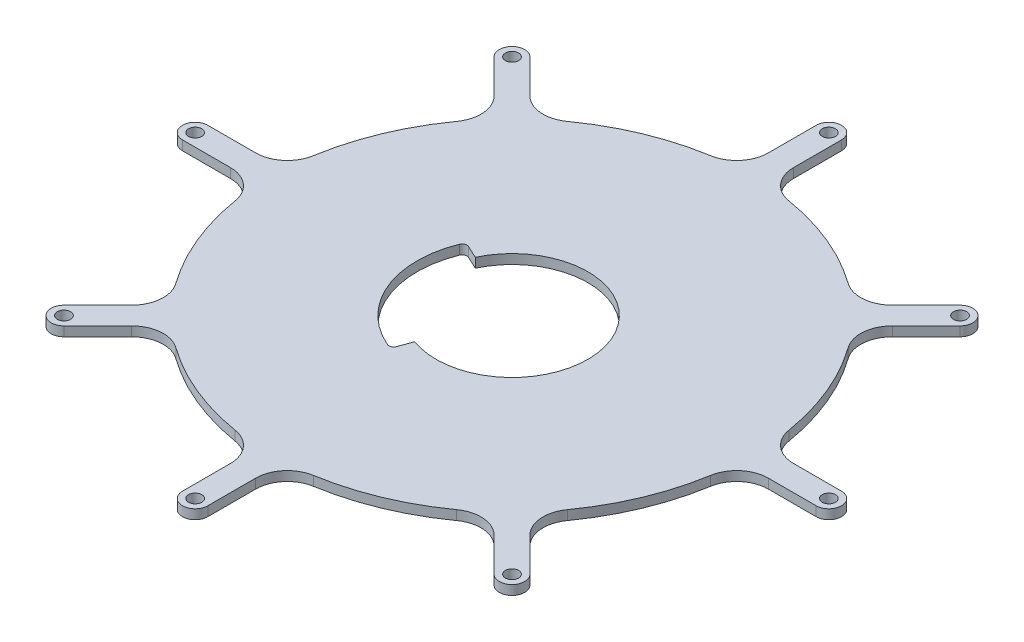
from build123d import *

# Parameters (mm, degrees)
BOSS_EXTRUDE1_DEPTH = 3
SKETCH3_R           = 2.1
CUT_EXTRUDE1_DEPTH  = 5
FILLET1_R           = 10
SKETCH4_R           = 24
CUT_EXTRUDE2_DEPTH  = 10


with BuildPart() as part:
    # Sketch1 → Boss-Extrude1 (new body)
    with BuildSketch(Plane(origin=(0, 0, 0), x_dir=(1, 0, 0), z_dir=(0, 1, 0))):
        with BuildLine():
            ThreePointArc((36.740234303, -4), (32.740234303, 0), (36.740234303, 4))
            Line((36.740234303, 4), (76.064899264, 4))
            ThreePointArc((76.064899264, 4), (70.371903991, 29.148997043), (56.614433204, 50.957578955))
            Line((56.614433204, 50.957578955), (28.807695942, 23.150841693))
            ThreePointArc((28.807695942, 23.150841693), (23.150841693, 23.150841693), (23.150841693, 28.807695942))
            Line((23.150841693, 28.807695942), (50.957578955, 56.614433204))
            ThreePointArc((50.957578955, 56.614433204), (29.148997043, 70.371903991), (4, 76.064899264))
            Line((4, 76.064899264), (4, 36.740234303))
            ThreePointArc((4, 36.740234303), (0, 32.740234303), (-4, 36.740234303))
            Line((-4, 36.740234303), (-4, 76.064899264))
            ThreePointArc((-4, 76.064899264), (-29.148997043, 70.371903991), (-50.957578955, 56.614433204))
            Line((-50.957578955, 56.614433204), (-23.150841693, 28.807695942))
            ThreePointArc((-23.150841693, 28.807695942), (-23.150841693, 23.150841693), (-28.807695942, 23.150841693))
            Line((-28.807695942, 23.150841693), (-56.614433204, 50.957578955))
            ThreePointArc((-56.614433204, 50.957578955), (-70.371903991, 29.148997043), (-76.064899264, 4))
            Line((-76.064899264, 4), (-36.740234303, 4))
            ThreePointArc((-36.740234303, 4), (-32.740234303, 0), (-36.740234303, -4))
            Line((-36.740234303, -4), (-76.064899264, -4))
            ThreePointArc((-76.064899264, -4), (-70.371903991, -29.148997043), (-56.614433204, -50.957578955))
            Line((-56.614433204, -50.957578955), (-28.807695942, -23.150841693))
            ThreePointArc((-28.807695942, -23.150841693), (-23.150841693, -23.150841693), (-23.150841693, -28.807695942))
            Line((-23.150841693, -28.807695942), (-50.957578955, -56.614433204))
            ThreePointArc((-50.957578955, -56.614433204), (-29.148997043, -70.371903991), (-4, -76.064899264))
            Line((-4, -76.064899264), (-4, -36.740234303))
            ThreePointArc((-4, -36.740234303), (0, -32.740234303), (4, -36.740234303))
            Line((4, -36.740234303), (4, -76.064899264))
            ThreePointArc((4, -76.064899264), (29.148997043, -70.371903991), (50.957578955, -56.614433204))
            Line((50.957578955, -56.614433204), (23.150841693, -28.807695942))
            ThreePointArc((23.150841693, -28.807695942), (23.150841693, -23.150841693), (28.807695942, -23.150841693))
            Line((28.807695942, -23.150841693), (56.614433204, -50.957578955))
            ThreePointArc((56.614433204, -50.957578955), (70.371903991, -29.148997043), (76.064899264, -4))
            Line((76.064899264, -4), (36.740234303, -4))
        make_face()
        with BuildLine():
            ThreePointArc((-4, 76.064899264), (0, 76.17), (4, 76.064899264))
            Line((4, 76.064899264), (4, 100.17))
            ThreePointArc((4, 100.17), (0, 104.17), (-4, 100.17))
            Line((-4, 100.17), (-4, 76.064899264))
        make_face()
        with BuildLine():
            Line((4, 36.740234303), (4, 76.064899264))
            ThreePointArc((4, 76.064899264), (0, 76.17), (-4, 76.064899264))
            Line((-4, 76.064899264), (-4, 36.740234303))
            ThreePointArc((-4, 36.740234303), (0, 32.740234303), (4, 36.740234303))
        make_face()
        with BuildLine():
            ThreePointArc((-56.614433204, 50.957578955), (-53.860323523, 53.860323523), (-50.957578955, 56.614433204))
            Line((-50.957578955, 56.614433204), (-68.002459147, 73.659313396))
            ThreePointArc((-68.002459147, 73.659313396), (-73.659313396, 73.659313396), (-73.659313396, 68.002459147))
            Line((-73.659313396, 68.002459147), (-56.614433204, 50.957578955))
        make_face()
        with BuildLine():
            Line((-23.150841693, 28.807695942), (-50.957578955, 56.614433204))
            ThreePointArc((-50.957578955, 56.614433204), (-53.860323523, 53.860323523), (-56.614433204, 50.957578955))
            Line((-56.614433204, 50.957578955), (-28.807695942, 23.150841693))
            ThreePointArc((-28.807695942, 23.150841693), (-23.150841693, 23.150841693), (-23.150841693, 28.807695942))
        make_face()
        with BuildLine():
            ThreePointArc((-76.064899264, -4), (-76.17, 0), (-76.064899264, 4))
            Line((-76.064899264, 4), (-100.17, 4))
            ThreePointArc((-100.17, 4), (-104.17, 0), (-100.17, -4))
            Line((-100.17, -4), (-76.064899264, -4))
        make_face()
        with BuildLine():
            Line((-36.740234303, 4), (-76.064899264, 4))
            ThreePointArc((-76.064899264, 4), (-76.17, 0), (-76.064899264, -4))
            Line((-76.064899264, -4), (-36.740234303, -4))
            ThreePointArc((-36.740234303, -4), (-32.740234303, 0), (-36.740234303, 4))
        make_face()
        with BuildLine():
            Line((-68.002459147, -73.659313396), (-50.957578955, -56.614433204))
            ThreePointArc((-50.957578955, -56.614433204), (-53.860323523, -53.860323523), (-56.614433204, -50.957578955))
            Line((-56.614433204, -50.957578955), (-73.659313396, -68.002459147))
            ThreePointArc((-73.659313396, -68.002459147), (-73.659313396, -73.659313396), (-68.002459147, -73.659313396))
        make_face()
        with BuildLine():
            ThreePointArc((-56.614433204, -50.957578955), (-53.860323523, -53.860323523), (-50.957578955, -56.614433204))
            Line((-50.957578955, -56.614433204), (-23.150841693, -28.807695942))
            ThreePointArc((-23.150841693, -28.807695942), (-23.150841693, -23.150841693), (-28.807695942, -23.150841693))
            Line((-28.807695942, -23.150841693), (-56.614433204, -50.957578955))
        make_face()
        with BuildLine():
            ThreePointArc((-4, -76.064899264), (0, -76.17), (4, -76.064899264))
            Line((4, -76.064899264), (4, -36.740234303))
            ThreePointArc((4, -36.740234303), (0, -32.740234303), (-4, -36.740234303))
            Line((-4, -36.740234303), (-4, -76.064899264))
        make_face()
        with BuildLine():
            Line((4, -100.17), (4, -76.064899264))
            ThreePointArc((4, -76.064899264), (0, -76.17), (-4, -76.064899264))
            Line((-4, -76.064899264), (-4, -100.17))
            ThreePointArc((-4, -100.17), (0, -104.17), (4, -100.17))
        make_face()
        with BuildLine():
            ThreePointArc((50.957578955, -56.614433204), (53.860323523, -53.860323523), (56.614433204, -50.957578955))
            Line((56.614433204, -50.957578955), (28.807695942, -23.150841693))
            ThreePointArc((28.807695942, -23.150841693), (23.150841693, -23.150841693), (23.150841693, -28.807695942))
            Line((23.150841693, -28.807695942), (50.957578955, -56.614433204))
        make_face()
        with BuildLine():
            Line((73.659313396, -68.002459147), (56.614433204, -50.957578955))
            ThreePointArc((56.614433204, -50.957578955), (53.860323523, -53.860323523), (50.957578955, -56.614433204))
            Line((50.957578955, -56.614433204), (68.002459147, -73.659313396))
            ThreePointArc((68.002459147, -73.659313396), (73.659313396, -73.659313396), (73.659313396, -68.002459147))
        make_face()
        with BuildLine():
            Line((76.064899264, 4), (36.740234303, 4))
            ThreePointArc((36.740234303, 4), (32.740234303, 0), (36.740234303, -4))
            Line((36.740234303, -4), (76.064899264, -4))
            ThreePointArc((76.064899264, -4), (76.143720282, -2.000690266), (76.17, 0))
            ThreePointArc((76.17, 0), (76.143720282, 2.000690266), (76.064899264, 4))
        make_face()
        with BuildLine():
            Line((100.17, 4), (76.064899264, 4))
            ThreePointArc((76.064899264, 4), (76.143720282, 2.000690266), (76.17, 0))
            ThreePointArc((76.17, 0), (76.143720282, -2.000690266), (76.064899264, -4))
            Line((76.064899264, -4), (100.17, -4))
            ThreePointArc((100.17, -4), (104.17, 0), (100.17, 4))
        make_face()
        with BuildLine():
            Line((28.807695942, 23.150841693), (56.614433204, 50.957578955))
            ThreePointArc((56.614433204, 50.957578955), (53.860323523, 53.860323523), (50.957578955, 56.614433204))
            Line((50.957578955, 56.614433204), (23.150841693, 28.807695942))
            ThreePointArc((23.150841693, 28.807695942), (23.150841693, 23.150841693), (28.807695942, 23.150841693))
        make_face()
        with BuildLine():
            ThreePointArc((50.957578955, 56.614433204), (53.860323523, 53.860323523), (56.614433204, 50.957578955))
            Line((56.614433204, 50.957578955), (73.659313396, 68.002459147))
            ThreePointArc((73.659313396, 68.002459147), (73.659313396, 73.659313396), (68.002459147, 73.659313396))
            Line((68.002459147, 73.659313396), (50.957578955, 56.614433204))
        make_face()
    extrude(amount=BOSS_EXTRUDE1_DEPTH)

    # Sketch3 → Cut-Extrude1 (cut)
    with BuildSketch(Plane(origin=(0, 3, 0), x_dir=(1, 0, 0), z_dir=(0, 1, 0))):
        with Locations(Location((100.17, 0, 0), (0, 0, 270))):
            Circle(SKETCH3_R)
        with Locations(Location((70.830886271, -70.830886271, 0), (0, 0, 270))):
            Circle(SKETCH3_R)
        with Locations(Location((0, -100.17, 0), (0, 0, 270))):
            Circle(SKETCH3_R)
        with Locations(Location((-70.830886271, -70.830886271, 0), (0, 0, 270))):
            Circle(SKETCH3_R)
        with Locations(Location((-100.17, 0, 0), (0, 0, 270))):
            Circle(SKETCH3_R)
        with Locations(Location((-70.830886271, 70.830886271, 0), (0, 0, 270))):
            Circle(SKETCH3_R)
        with Locations(Location((0, 100.17, 0), (0, 0, 270))):
            Circle(SKETCH3_R)
        with Locations(Location((70.830886271, 70.830886271, 0), (0, 0, 270))):
            Circle(SKETCH3_R)
    extrude(amount=-CUT_EXTRUDE1_DEPTH, mode=Mode.SUBTRACT)

    # Fillet1
    fillet1_edges = [part.edges().sort_by_distance(p)[0] for p in [
        (76.064899264, 1.5, -4),
        (76.064899264, 1.5, 4),
        (56.614433204, 1.5, 50.957578955),
        (50.957578955, 1.5, 56.614433204),
        (4, 1.5, 76.064899264),
        (-4, 1.5, 76.064899264),
        (-50.957578955, 1.5, 56.614433204),
        (-56.614433204, 1.5, 50.957578955),
        (-76.064899264, 1.5, 4),
        (-76.064899264, 1.5, -4),
        (-56.614433204, 1.5, -50.957578955),
        (-50.957578955, 1.5, -56.614433204),
        (-4, 1.5, -76.064899264),
        (4, 1.5, -76.064899264),
        (50.957578955, 1.5, -56.614433204),
        (56.614433204, 1.5, -50.957578955),
    ]]
    fillet(fillet1_edges, radius=FILLET1_R)

    # Sketch4 → Cut-Extrude2 (cut)
    with BuildSketch(Plane(origin=(0, 3, 0), x_dir=(1, 0, 0), z_dir=(0, 1, 0))):
        Circle(SKETCH4_R)
        with BuildLine():
            Line((-25.793971814, 12.027926591), (0, 0))
            Line((0, 0), (-9.734063927, -26.744120839))
            ThreePointArc((-9.734063927, -26.744120839), (-10.54568287, -27.606769252), (-11.730108272, -27.611674341))
            ThreePointArc((-11.730108272, -27.611674341), (-27.716385975, -11.480502971), (-27.81884127, 11.229963064))
            ThreePointArc((-27.81884127, 11.229963064), (-26.977857614, 12.064009875), (-25.793971814, 12.027926591))
        make_face()
        with BuildLine():
            ThreePointArc((24, 0), (5.194550735, 23.431104171), (-21.751386889, 10.142838282))
            Line((-21.751386889, 10.142838282), (0, 0))
            Line((0, 0), (-8.20848344, -22.552622899))
            ThreePointArc((-8.20848344, -22.552622899), (13.765834472, -19.659649063), (24, 0))
        make_face()
        with BuildLine():
            Line((0, 0), (-21.751386889, 10.142838282))
            ThreePointArc((-21.751386889, 10.142838282), (-22.17310878, -9.184402377), (-8.20848344, -22.552622899))
            Line((-8.20848344, -22.552622899), (0, 0))
        make_face()
    extrude(amount=-CUT_EXTRUDE2_DEPTH, mode=Mode.SUBTRACT)


solid = part.part
